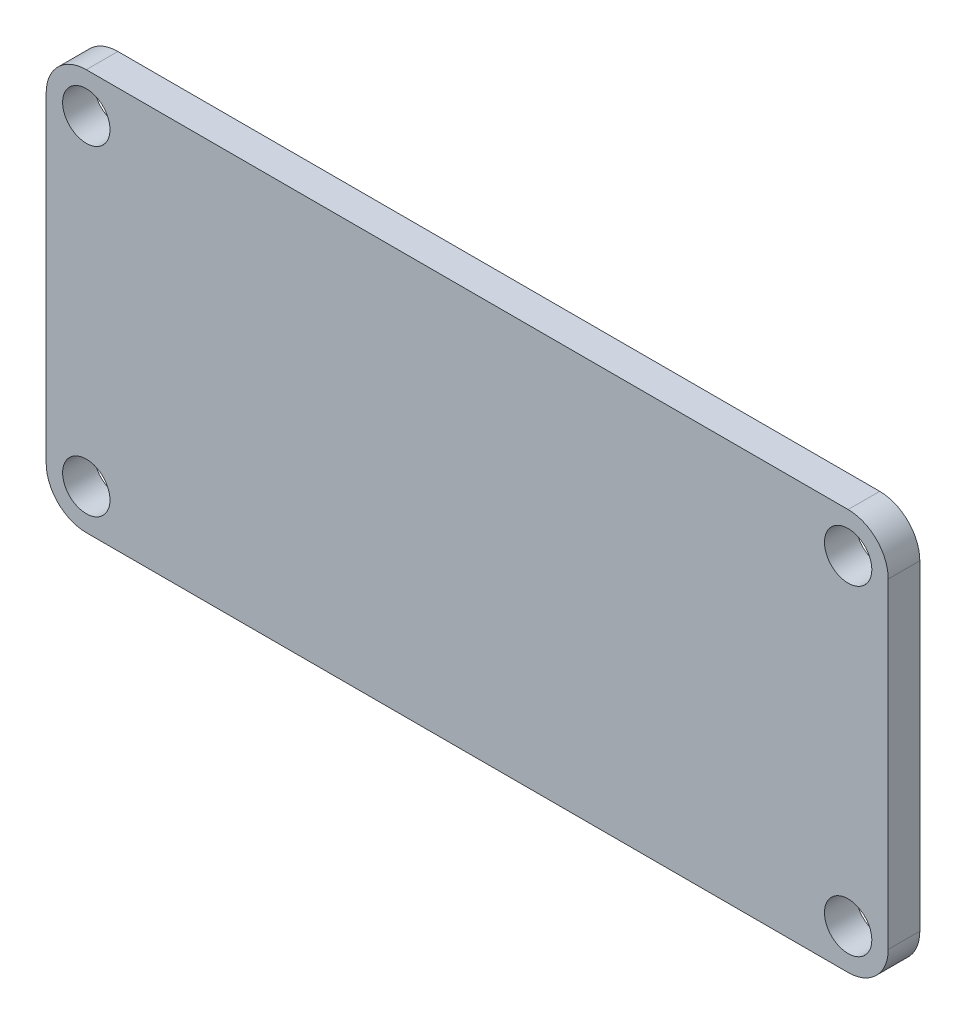
from build123d import *

# Parameters (mm, degrees)
CROQUIS1_R              = 1.5
SALIENTE_EXTRUIR1_DEPTH = 2


with BuildPart() as part:
    # Croquis1 → Saliente-Extruir1 (new body)
    with BuildSketch(Plane.XY):
        with BuildLine():
            Line((2.54, 0), (50.8, 0))
            ThreePointArc((50.8, 0), (52.596051224, 0.743948776), (53.34, 2.54))
            Line((53.34, 2.54), (53.34, 22.86))
            ThreePointArc((53.34, 22.86), (52.596051224, 24.656051224), (50.8, 25.4))
            Line((50.8, 25.4), (2.54, 25.4))
            ThreePointArc((2.54, 25.4), (0.743948776, 24.656051224), (0, 22.86))
            Line((0, 22.86), (0, 2.54))
            ThreePointArc((0, 2.54), (0.743948776, 0.743948776), (2.54, 0))
        make_face()
        with Locations((2.54, 22.86)):
            Circle(CROQUIS1_R, mode=Mode.SUBTRACT)
        with Locations((50.8, 22.86)):
            Circle(CROQUIS1_R, mode=Mode.SUBTRACT)
        with Locations((50.8, 2.54)):
            Circle(CROQUIS1_R, mode=Mode.SUBTRACT)
        with Locations((2.54, 2.54)):
            Circle(CROQUIS1_R, mode=Mode.SUBTRACT)
    extrude(amount=SALIENTE_EXTRUIR1_DEPTH)


solid = part.part
